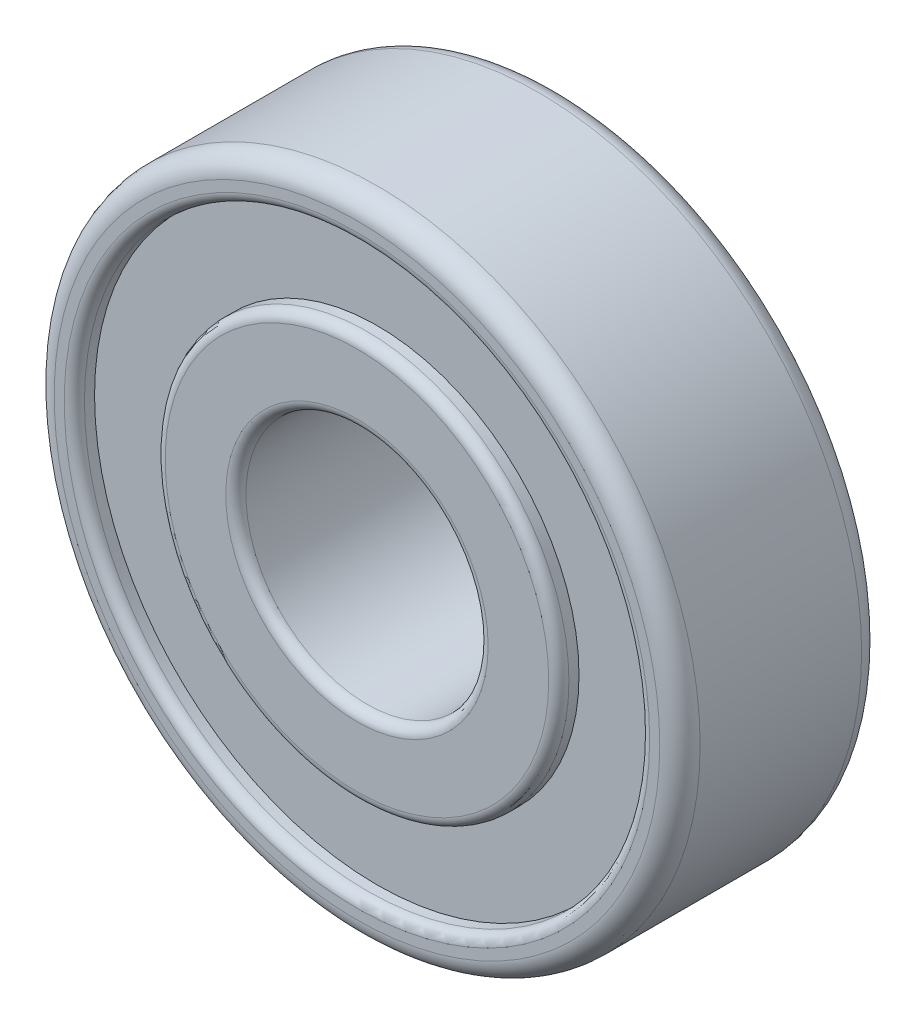
from build123d import *

# Parameters (mm, degrees)
ESBO_O1_R                = 16
ESBO_O1_R_2              = 6
RESSALTO_EXTRUS_O1_DEPTH = 10
ESBO_O2_R                = 14
ESBO_O2_R_2              = 10
CORTE_EXTRUS_O1_DEPTH    = 1
ESBO_O3_R                = 12.5
ESBO_O3_R_2              = 9
CORTE_EXTRUS_O2_DEPTH    = 1
FILLET1_R                = 1
FILLET2_R                = 0.5


with BuildPart() as part:
    # Esboço1 → Ressalto-extrusão1 (new body)
    with BuildSketch(Plane.XY):
        Circle(ESBO_O1_R)
        Circle(ESBO_O1_R_2, mode=Mode.SUBTRACT)
    extrude(amount=RESSALTO_EXTRUS_O1_DEPTH)

    # Esboço2 → Corte-extrusão1 (cut)
    with BuildSketch(Plane.XY.offset(10)):
        Circle(ESBO_O2_R)
        Circle(ESBO_O2_R_2, mode=Mode.SUBTRACT)
    extrude(amount=-CORTE_EXTRUS_O1_DEPTH, mode=Mode.SUBTRACT)

    # Esboço3 → Corte-extrusão2 (cut)
    with BuildSketch(Plane(origin=(0, 0, 0), x_dir=(-1, 0, 0), z_dir=(0, 0, -1))):
        Circle(ESBO_O3_R)
        Circle(ESBO_O3_R_2, mode=Mode.SUBTRACT)
    extrude(amount=-CORTE_EXTRUS_O2_DEPTH, mode=Mode.SUBTRACT)

    # Fillet1
    fillet1_edges = [part.edges().sort_by_distance(p)[0] for p in [
        (-16, 0, 0),
        (-16, 0, 10),
    ]]
    fillet(fillet1_edges, radius=FILLET1_R)

    # Fillet2
    fillet2_edges = [part.edges().sort_by_distance(p)[0] for p in [
        (-14, 0, 10),
        (-10, 0, 10),
        (12.5, 0, 0),
        (9, 0, 0),
        (-6, 0, 0),
        (-6, 0, 10),
    ]]
    fillet(fillet2_edges, radius=FILLET2_R)


solid = part.part
